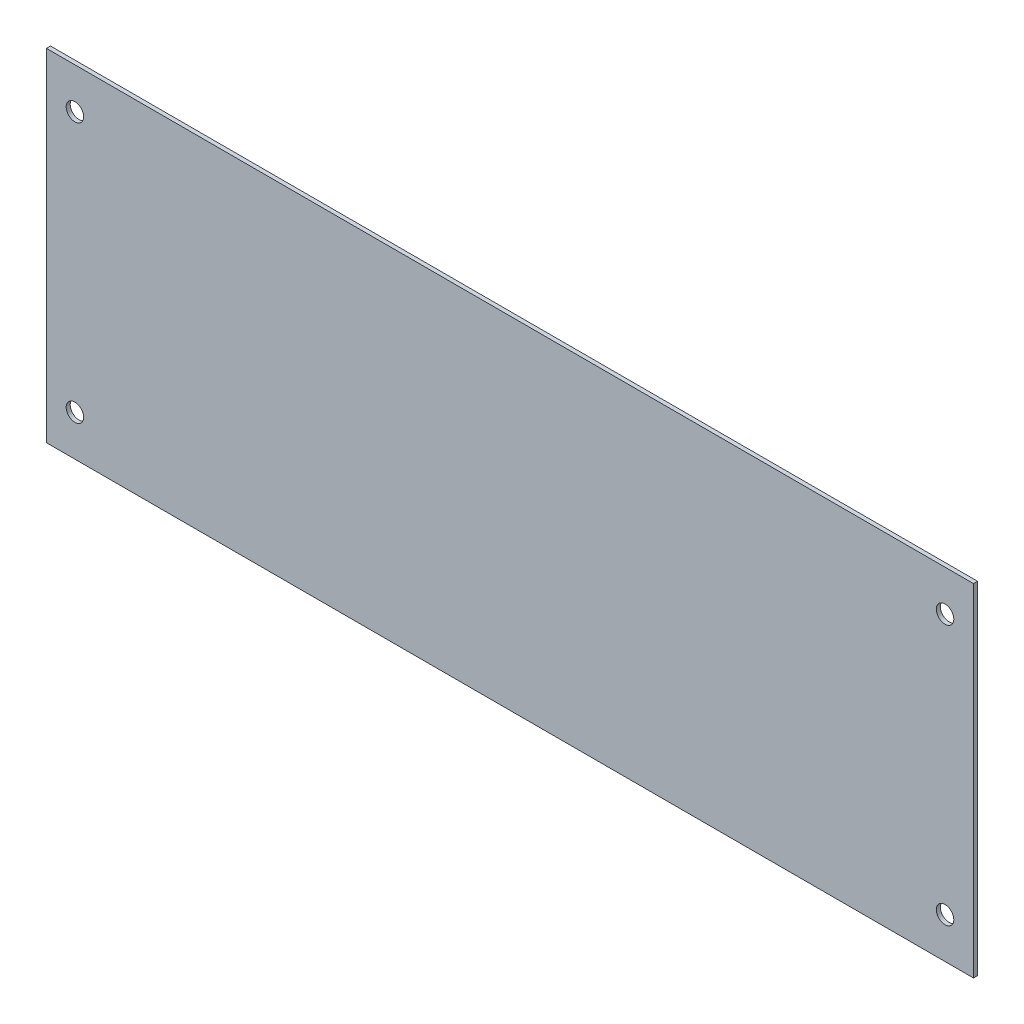
from build123d import *

# Parameters (mm, degrees)
SKETCH_1_W      = 228
SKETCH_1_H      = 84
SKETCH_1_R      = 2.15
EXTRUDE_1_DEPTH = 1


with BuildPart() as part:
    # Эскиз1 → Вытянуть1 (new body)
    with BuildSketch(Plane.XY):
        Rectangle(SKETCH_1_W, SKETCH_1_H)
        with Locations((107, 32)):
            Circle(SKETCH_1_R, mode=Mode.SUBTRACT)
        with Locations(Location((-107, 32, 0), (0, 0, 180))):
            Circle(SKETCH_1_R, mode=Mode.SUBTRACT)
        with Locations((-107, -32)):
            Circle(SKETCH_1_R, mode=Mode.SUBTRACT)
        with Locations(Location((107, -32, 0), (0, 0, 180))):
            Circle(SKETCH_1_R, mode=Mode.SUBTRACT)
    extrude(amount=EXTRUDE_1_DEPTH)


solid = part.part
